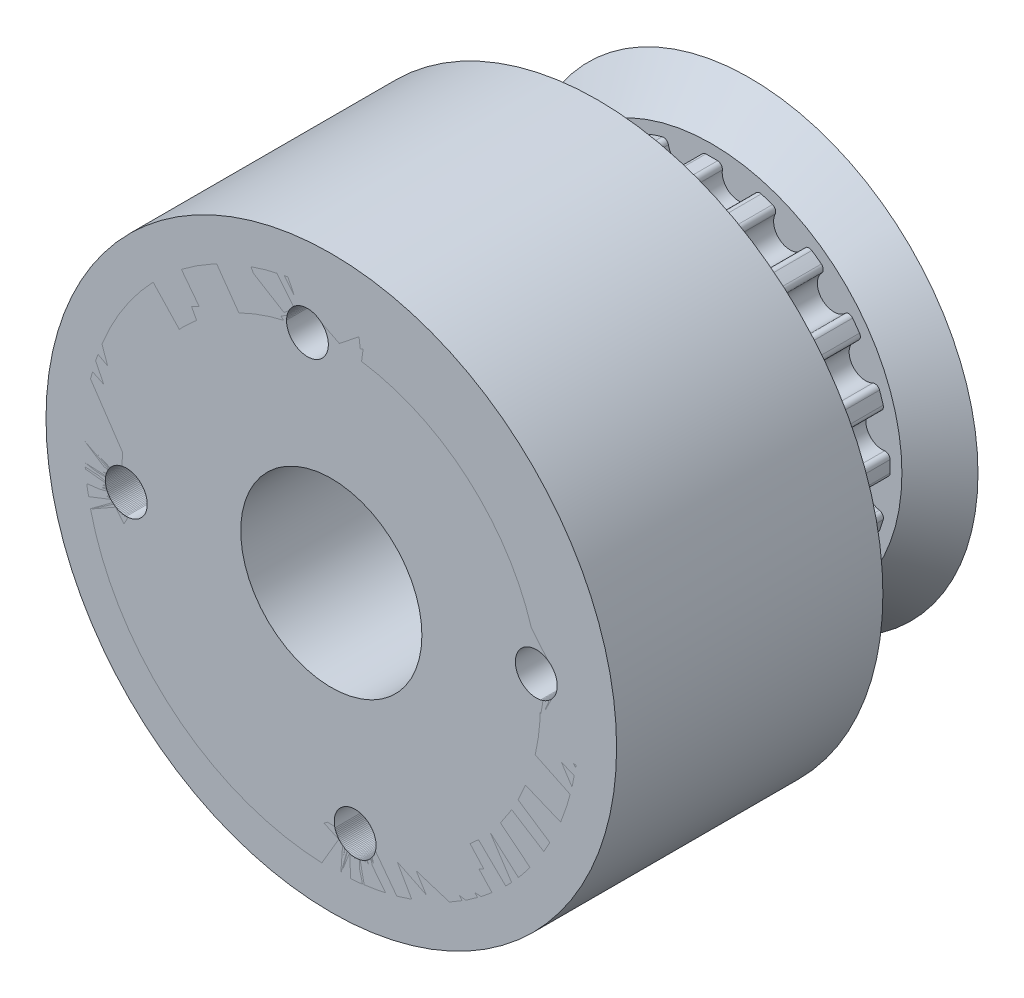
from build123d import *

# Parameters (mm, degrees)
SKETCH3_R                     = 13
SKETCH3_R_2                   = 4.7625
WHEEL_BODY_DEPTH              = 14
PULLY_START                   = -6
SKETCH13_R                    = 10
SKETCH13_R_2                  = 4.7625
PULLY_DEPTH                   = 6
SKETCH9_R                     = 15
SKETCH9_R_2                   = 11
MODIFER_DEPTH                 = 14
TOOTH_START                   = -6
TOOTH_GEOMETETRY_DEPTH        = 6
TOOTH_PATTERN_COUNT           = 20
M2_CLEARANCE_HOLE1_AT_2_COUNT = 2
M2_CLEARANCE_HOLE1_AT_2_PITCH = 15.344217152
M2_CLEARANCE_HOLE1_AT_3_COUNT = 2
M2_CLEARANCE_HOLE1_AT_3_PITCH = 15.344217152
M2_CLEARANCE_HOLE1_AT_4_COUNT = 2
M2_CLEARANCE_HOLE1_AT_4_PITCH = 21.7


with BuildPart() as part:
    # Sketch3 → wheel body (new body)
    with BuildSketch(Plane.XY):
        Circle(SKETCH3_R)
        Circle(SKETCH3_R_2, mode=Mode.SUBTRACT)
    extrude(amount=WHEEL_BODY_DEPTH)

    # Sketch13 → pully (add)
    with BuildSketch(Plane.XY.offset(PULLY_START)):
        Circle(SKETCH13_R)
        Circle(SKETCH13_R_2, mode=Mode.SUBTRACT)
    extrude(amount=PULLY_DEPTH)

    # Sketch16 → pulley holder (revolve)
    with BuildSketch(Plane(origin=(0, 0, 0), x_dir=(0, 0, -1), z_dir=(1, 0, 0)), mode=Mode.PRIVATE) as pulley_holder_sk:
        Polygon((8, 12), (6, 10), (6, 4.7625), (8, 4.7625), align=None)
    revolve(pulley_holder_sk.sketch.rotate(Axis((0, 0, -6), (0, 0, -1)), 90), axis=Axis((0, 0, -6), (0, 0, -1)))

    # Sketch17 → tooth geometetry (cut)
    with BuildSketch(Plane.XY.offset(TOOTH_START)):
        with BuildLine():
            Line((2.900124492, 8.925665405), (3.090169944, 9.510565163))
            ThreePointArc((3.090169944, 9.510565163), (1.56434465, 9.876883406), (0, 10))
            Line((0, 10), (0, 9.385))
            ThreePointArc((0, 9.385), (0.154703975, 9.38372483), (0.30936591, 9.379899665))
            ThreePointArc((0.30936591, 9.379899665), (0.499027767, 9.288278566), (0.558589172, 9.086242715))
            ThreePointArc((0.558589172, 9.086242715), (1.28510913, 8.113859718), (2.276553542, 8.81414389))
            ThreePointArc((2.276553542, 8.81414389), (2.395632316, 8.987885916), (2.604323938, 9.016414023))
            ThreePointArc((2.604323938, 9.016414023), (2.752598219, 8.972258804), (2.900124492, 8.925665405))
        make_face()
    tooth_geometetry = extrude(amount=TOOTH_GEOMETETRY_DEPTH, mode=Mode.SUBTRACT)

    # tooth pattern: tooth geometetry ×20 about axis
    tooth_pattern_axis = Axis((0, 0, 0), (0, 0, 1))
    for i in range(1, TOOTH_PATTERN_COUNT):
        add(tooth_geometetry.rotate(tooth_pattern_axis, i * 360 / TOOTH_PATTERN_COUNT), mode=Mode.SUBTRACT)


with BuildPart() as body_2:
    # Sketch9 → modifer (new body)
    with BuildSketch(Plane.XY):
        Circle(SKETCH9_R)
        Circle(SKETCH9_R_2, mode=Mode.SUBTRACT)
    extrude(amount=MODIFER_DEPTH)


with BuildPart() as m2_clearance_hole1_tool:
    # Sketch19 → M2 Clearance Hole1 (revolve)
    with BuildSketch(Plane(origin=(-1.254955749, 10.777178948, 14), x_dir=(0, -1, 0), z_dir=(1, 0, 0))):
        Polygon((0, 0), (0, 8.160946681), (1.1, 7.5), (1.1, 0), align=None)
    m2_clearance_hole1 = revolve(axis=Axis((-1.254955749, 10.777178948, 20.35), (0, 0, -1)))


with BuildPart() as part_1:
    add(part.part)

    # M2 Clearance Hole1: cut by m2_clearance_hole1_tool
    add(m2_clearance_hole1_tool.part, mode=Mode.SUBTRACT)


with BuildPart() as body_2_1:
    add(body_2.part)

    # M2 Clearance Hole1: cut by m2_clearance_hole1_tool
    add(m2_clearance_hole1_tool.part, mode=Mode.SUBTRACT)


with BuildPart() as m2_clearance_hole1_at_2_tool:
    # M2 Clearance Hole1 at 2: M2 Clearance Hole1 ×2
    with Locations(*[Vector(-0.6205740641207762, -0.7841478374264783, 0) * (i * M2_CLEARANCE_HOLE1_AT_2_PITCH) for i in range(1, M2_CLEARANCE_HOLE1_AT_2_COUNT)]):
        add(m2_clearance_hole1)


with BuildPart() as part_2:
    add(part_1.part)

    # M2 Clearance Hole1 at 2: cut by m2_clearance_hole1_at_2_tool
    add(m2_clearance_hole1_at_2_tool.part, mode=Mode.SUBTRACT)


with BuildPart() as body_2_2:
    add(body_2_1.part)

    # M2 Clearance Hole1 at 2: cut by m2_clearance_hole1_at_2_tool
    add(m2_clearance_hole1_at_2_tool.part, mode=Mode.SUBTRACT)


with BuildPart() as m2_clearance_hole1_at_3_tool:
    # M2 Clearance Hole1 at 3: M2 Clearance Hole1 ×2
    with Locations(*[Vector(0.7841478374264805, -0.6205740641207735, 0) * (i * M2_CLEARANCE_HOLE1_AT_3_PITCH) for i in range(1, M2_CLEARANCE_HOLE1_AT_3_COUNT)]):
        add(m2_clearance_hole1)


with BuildPart() as part_3:
    add(part_2.part)

    # M2 Clearance Hole1 at 3: cut by m2_clearance_hole1_at_3_tool
    add(m2_clearance_hole1_at_3_tool.part, mode=Mode.SUBTRACT)


with BuildPart() as body_2_3:
    add(body_2_2.part)

    # M2 Clearance Hole1 at 3: cut by m2_clearance_hole1_at_3_tool
    add(m2_clearance_hole1_at_3_tool.part, mode=Mode.SUBTRACT)


with BuildPart() as m2_clearance_hole1_at_4_tool:
    # M2 Clearance Hole1 at 4: M2 Clearance Hole1 ×2
    with Locations(*[Vector(0.11566412432873131, -0.9932883822653257, 0) * (i * M2_CLEARANCE_HOLE1_AT_4_PITCH) for i in range(1, M2_CLEARANCE_HOLE1_AT_4_COUNT)]):
        add(m2_clearance_hole1)


with BuildPart() as part_4:
    add(part_3.part)

    # M2 Clearance Hole1 at 4: cut by m2_clearance_hole1_at_4_tool
    add(m2_clearance_hole1_at_4_tool.part, mode=Mode.SUBTRACT)


with BuildPart() as body_2_4:
    add(body_2_3.part)

    # M2 Clearance Hole1 at 4: cut by m2_clearance_hole1_at_4_tool
    add(m2_clearance_hole1_at_4_tool.part, mode=Mode.SUBTRACT)


solid = Compound([part_4.part, body_2_4.part])
